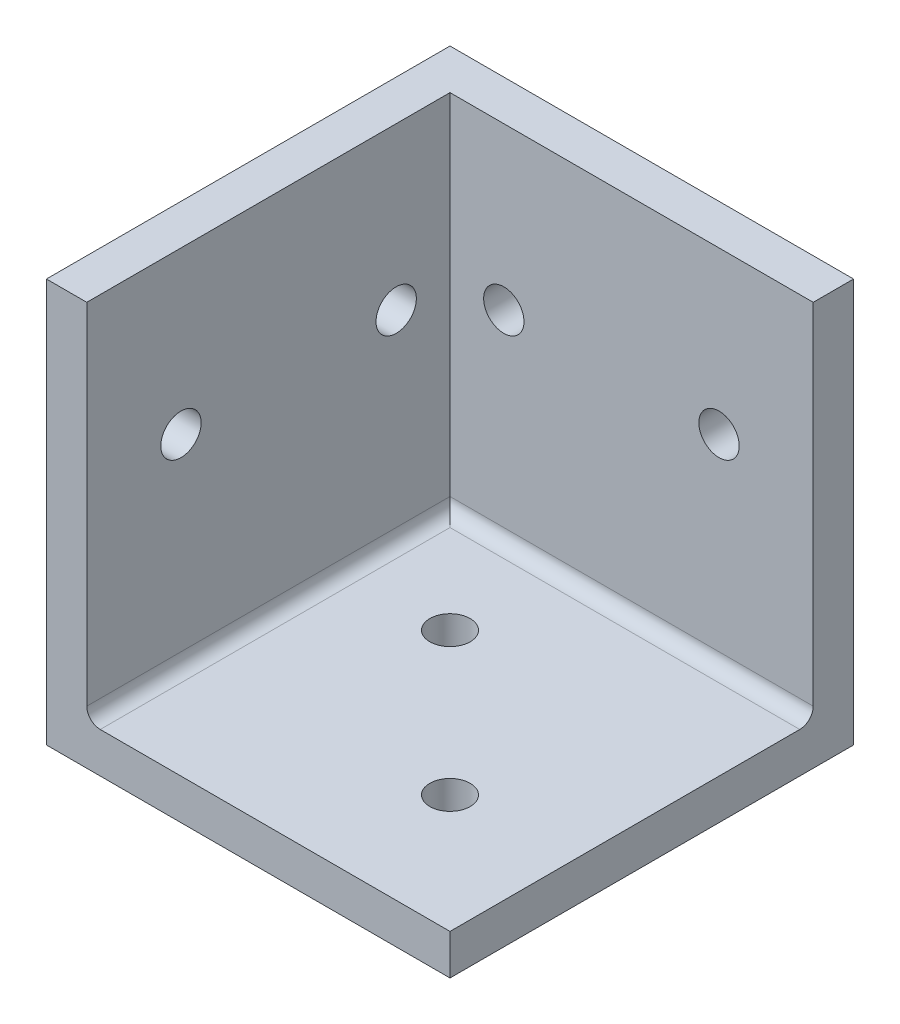
from build123d import *

# Parameters (mm, degrees)
SKETCH_1_W          = 30
SKETCH_1_H          = 30
EXTRUDE_1_DEPTH     = 3
SKETCH_2_R          = 1.5
CUT_EXTRUDE_1_DEPTH = 3
SKETCH_3_W          = 30
SKETCH_3_H          = 3
EXTRUDE_2_DEPTH     = 27
SKETCH_5_W          = 30
SKETCH_5_H          = 30
EXTRUDE_3_DEPTH     = 3
FILLET_1_R          = 1
SKETCH_10_R         = 1.5
CUT_EXTRUDE_4_DEPTH = 3
SKETCH_11_R         = 1.5
CUT_EXTRUDE_5_DEPTH = 3


with BuildPart() as part:
    # 草图1 → 凸台-拉伸1 (new body)
    with BuildSketch(Plane.XY):
        Rectangle(SKETCH_1_W, SKETCH_1_H)
    extrude(amount=EXTRUDE_1_DEPTH)

    # 草图2 → 切除-拉伸1 (cut)
    with BuildSketch(Plane.XY.offset(3)):
        with Locations((8, 3)):
            Circle(SKETCH_2_R)
        with Locations(Location((-8, 3, 0), (0, 0, 180))):
            Circle(SKETCH_2_R)
    extrude(amount=-CUT_EXTRUDE_1_DEPTH, mode=Mode.SUBTRACT)

    # 草图3 → 凸台-拉伸2 (add)
    with BuildSketch(Plane.XY.offset(3)):
        with Locations((0, -13.5)):
            Rectangle(SKETCH_3_W, SKETCH_3_H)
    extrude(amount=EXTRUDE_2_DEPTH)

    # 草图5 → 凸台-拉伸3 (add)
    with BuildSketch(Plane.ZY.offset(15)):
        with Locations((15, 0)):
            Rectangle(SKETCH_5_W, SKETCH_5_H)
    extrude(amount=-EXTRUDE_3_DEPTH)

    # 圆角1
    fillet_1_edges = [part.edges().sort_by_distance(p)[0] for p in [
        (1.5, -12, 3),
        (-12, -12, 16.5),
    ]]
    fillet(fillet_1_edges, radius=FILLET_1_R)

    # 草图10 → 切除-拉伸4 (cut)
    with BuildSketch(Plane.XZ.offset(15)):
        with Locations((-4.393398282, 10.606601718)):
            Circle(SKETCH_10_R)
        with Locations((6.213203436, 21.213203436)):
            Circle(SKETCH_10_R)
    extrude(amount=-CUT_EXTRUDE_4_DEPTH, mode=Mode.SUBTRACT)

    # 草图11 → 切除-拉伸5 (cut)
    with BuildSketch(Plane.ZY.offset(15)):
        with Locations((23, 3)):
            Circle(SKETCH_11_R)
        with Locations(Location((7, 3, 0), (0, 0, 180))):
            Circle(SKETCH_11_R)
    extrude(amount=-CUT_EXTRUDE_5_DEPTH, mode=Mode.SUBTRACT)


solid = part.part
